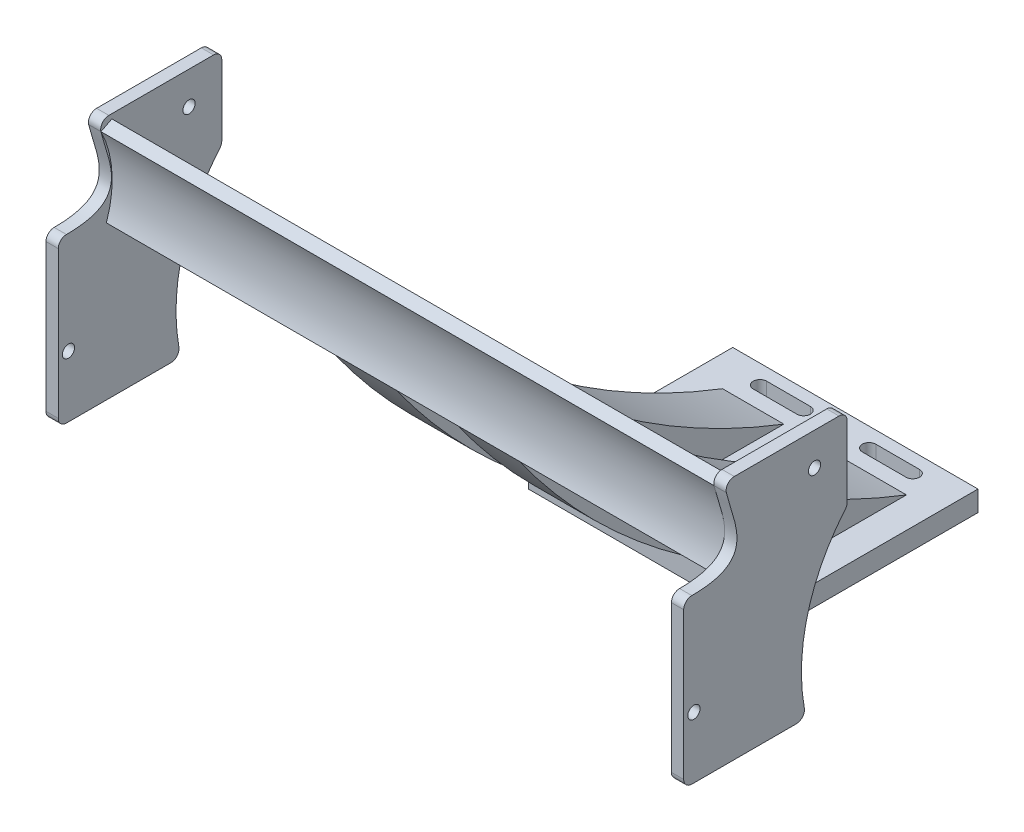
from build123d import *

# Parameters (mm, degrees)
BOSS_EXTRUDE3_DEPTH  = 3
BOSS_EXTRUDE4_DEPTH  = 150
BOSS_EXTRUDE7_DEPTH  = 150
BOSS_EXTRUDE11_DEPTH = 7.5
SKETCH10_W           = 60
SKETCH10_H           = 50
BOSS_EXTRUDE12_DEPTH = 5
CUT_EXTRUDE1_DEPTH   = 195.89610275
SKETCH12_R           = 1.5
CUT_EXTRUDE2_DEPTH   = 190.831504348


with BuildPart() as part:
    # Sketch2 → Boss-Extrude3 (new body)
    with BuildSketch(Plane(origin=(0, 0, 0), x_dir=(0, 0, -1), z_dir=(1, 0, 0))):
        with BuildLine():
            Line((-2.455878577, 0), (-28, 0))
            ThreePointArc((-28, 0), (-29.414213562, 0.585786438), (-30, 2))
            Line((-30, 2), (-30, 37.959376251))
            ThreePointArc((-30, 37.959376251), (-29.415933658, 39.371867622), (-28.004868125, 39.959370326))
            add(Edge.make_bspline(
                [(-19.566381264, 57.529565551), (-18.600890686, 53.540054818), (-14.629736922, 44.732493893), (-20.209073936, 39.978345831), (-28.004868125, 39.959370326)],
                knots=[0.096883264, 0.096883264, 0.096883264, 0.096883264, 0.548441632, 0.966186264, 0.966186264, 0.966186264, 0.966186264], degree=3))
            ThreePointArc((-19.566381264, 57.529565551), (-19.194257187, 59.23675606), (-17.622495612, 60))
            Line((-17.622495612, 60), (8, 60))
            ThreePointArc((8, 60), (9.414213562, 59.414213562), (10, 58))
            Line((10, 58), (10, 40.744458909))
            ThreePointArc((10, 40.744458909), (9.87713793, 40.054275462), (9.523646809, 39.448889381))
            ThreePointArc((9.523646809, 39.448889381), (0.359945302, 22.023181527), (-0.487300765, 2.353130851))
            ThreePointArc((-0.487300765, 2.353130851), (-0.921886774, 0.716696003), (-2.455878577, 0))
        make_face()
    boss_extrude3 = extrude(amount=BOSS_EXTRUDE3_DEPTH)

    # Sketch3 → Boss-Extrude4 (add)
    with BuildSketch(Plane.ZY):
        with BuildLine():
            Line((18.228025457, 37.529565551), (15.228025457, 37.529565551))
            ThreePointArc((15.228025457, 37.529565551), (13.544434891, 48.402566635), (16.889669649, 58.8842666))
            Line((16.889669649, 58.8842666), (19.566381264, 57.529565551))
            ThreePointArc((19.566381264, 57.529565551), (16.861238321, 47.665807833), (18.228025457, 37.529565551))
        make_face()
    extrude(amount=BOSS_EXTRUDE4_DEPTH)

    # Sketch6 → Boss-Extrude7 (add)
    with BuildSketch(Plane.ZY):
        with BuildLine():
            ThreePointArc((14.728025457, 37.029565551), (4.752130999, 35.940625674), (-5.265723566, 36.529565551))
            ThreePointArc((-5.265723566, 36.529565551), (-4.976948932, 35.028960586), (-5.271974543, 33.529572064))
            ThreePointArc((-5.271974543, 33.529572064), (4.756163556, 32.65403017), (14.728025457, 34.029565551))
            ThreePointArc((14.728025457, 34.029565551), (14.326101668, 35.529565551), (14.728025457, 37.029565551))
        make_face()
    extrude(amount=BOSS_EXTRUDE7_DEPTH)

    # Mirror2: Boss-Extrude3 across plane
    add(boss_extrude3.mirror(Plane.ZY.offset(75)))

    # Sketch9 → Boss-Extrude11 (add, symmetric)
    with BuildSketch(Plane(origin=(-60, 0, 0), x_dir=(0, 0, -1), z_dir=(1, 0, 0))):
        with BuildLine():
            Line((50, -20.470434449), (80, -20.470434449))
            ThreePointArc((80, -20.470434449), (39.119970751, 1.663921764), (5.271974543, 33.529572064))
            ThreePointArc((5.271974543, 33.529572064), (-4.756163556, 32.65403017), (-14.728025457, 34.029565551))
            ThreePointArc((-14.728025457, 34.029565551), (14.190904343, 2.687943249), (50, -20.470434449))
        make_face()
    boss_extrude11 = extrude(amount=BOSS_EXTRUDE11_DEPTH, both=True)

    # Mirror3: Boss-Extrude11 across plane
    add(boss_extrude11.mirror(Plane.ZY.offset(75)))

    # Sketch10 → Boss-Extrude12 (add)
    with BuildSketch(Plane.XZ.offset(20.470434449)):
        with Locations((-75, -65)):
            Rectangle(SKETCH10_W, SKETCH10_H)
    extrude(amount=BOSS_EXTRUDE12_DEPTH)

    # Sketch11 → Cut-Extrude1 (cut, through all)
    with BuildSketch(Plane(origin=(0, -20.470434449, 0), x_dir=(1, 0, 0), z_dir=(0, 1, 0))):
        with BuildLine():
            Line((-93.7, 87), (-83, 87))
            ThreePointArc((-83, 87), (-81.35, 85.35), (-83, 83.7))
            Line((-83, 83.7), (-93.7, 83.7))
            ThreePointArc((-93.7, 83.7), (-95.35, 85.35), (-93.7, 87))
        make_face()
        with BuildLine():
            Line((-67, 87), (-56.3, 87))
            ThreePointArc((-56.3, 87), (-54.65, 85.35), (-56.3, 83.7))
            Line((-56.3, 83.7), (-67, 83.7))
            ThreePointArc((-67, 83.7), (-68.65, 85.35), (-67, 87))
        make_face()
    extrude(amount=-CUT_EXTRUDE1_DEPTH, mode=Mode.SUBTRACT)

    # Sketch12 → Cut-Extrude2 (cut, through all)
    with BuildSketch(Plane(origin=(3, 0, 0), x_dir=(0, 0, -1), z_dir=(1, 0, 0))):
        with Locations((2, 52)):
            Circle(SKETCH12_R)
        with Locations((-27.5, 15)):
            Circle(SKETCH12_R)
    extrude(amount=-CUT_EXTRUDE2_DEPTH, mode=Mode.SUBTRACT)


solid = part.part
